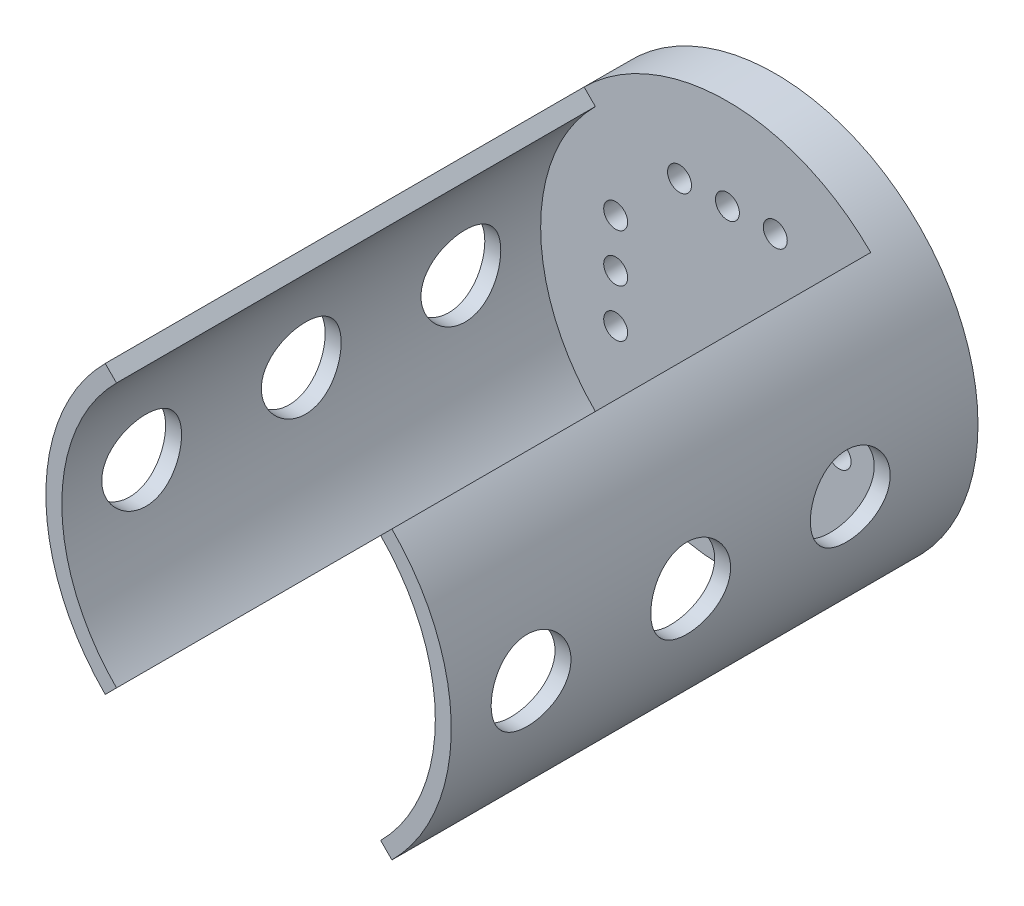
from build123d import *
from build123d.topology import SkipClean

# Parameters (mm, degrees)
SKETCH1_R                           = 12.7
BOSS_EXTRUDE1_DEPTH                 = 3
SKETCH2_R                           = 0.75
CUT_EXTRUDE1_DEPTH                  = 3
BOSS_EXTRUDE2_DEPTH                 = 30
CUT_EXTRUDE2_REACH                  = 39.571
CUT_EXTRUDE2_END_RADIUS             = 12.7
SKETCH4_R                           = 2.5
CUT_EXTRUDE2_DIRECTION_2_REACH      = 39.571
CUT_EXTRUDE2_DIRECTION_2_END_RADIUS = 12.7


with BuildPart() as part:
    # Sketch1 → Boss-Extrude1 (new body)
    with BuildSketch(Plane.XY):
        Circle(SKETCH1_R)
    extrude(amount=BOSS_EXTRUDE1_DEPTH)

    # Sketch2 → Cut-Extrude1 (cut)
    with BuildSketch(Plane.XY.offset(3)):
        with Locations((0, 7)):
            Circle(SKETCH2_R)
        with Locations((-3, 7)):
            Circle(SKETCH2_R)
        with Locations((3, 7)):
            Circle(SKETCH2_R)
        with Locations((7, -3)):
            Circle(SKETCH2_R)
        with Locations((7, 0)):
            Circle(SKETCH2_R)
        with Locations((7, 3)):
            Circle(SKETCH2_R)
        with Locations((-3, -7)):
            Circle(SKETCH2_R)
        with Locations((0, -7)):
            Circle(SKETCH2_R)
        with Locations((3, -7)):
            Circle(SKETCH2_R)
        with Locations((-7, 3)):
            Circle(SKETCH2_R)
        with Locations((-7, 0)):
            Circle(SKETCH2_R)
        with Locations((-7, -3)):
            Circle(SKETCH2_R)
    extrude(amount=-CUT_EXTRUDE1_DEPTH, mode=Mode.SUBTRACT)

    # Sketch3 → Boss-Extrude2 (add)
    with SkipClean():  # the faces are left unmerged after this step: merging them gives an invalid solid
        with BuildSketch(Plane.XY.offset(3)):
            with BuildLine():
                Line((-8.980256121, 8.980256121), (-8.273149436, 8.273149436))
                ThreePointArc((-8.273149436, 8.273149436), (-11.700000136, 0), (-8.27314937, -8.27314937))
                Line((-8.27314937, -8.27314937), (-8.980256121, -8.980256121))
                ThreePointArc((-8.980256121, -8.980256121), (-12.7, 0), (-8.980256121, 8.980256121))
            make_face()
            with BuildLine():
                Line((8.980256121, 8.980256121), (8.273149436, 8.273149436))
                ThreePointArc((8.273149436, 8.273149436), (11.700000136, 0), (8.27314937, -8.27314937))
                Line((8.27314937, -8.27314937), (8.980256121, -8.980256121))
                ThreePointArc((8.980256121, -8.980256121), (12.7, 0), (8.980256121, 8.980256121))
            make_face()
        extrude(amount=BOSS_EXTRUDE2_DEPTH)

    # Cut-Extrude2: up to this cylinder (the profile starts inside it)
    with SkipClean():  # the faces are left unmerged after this step: merging them gives an invalid solid
        cut_extrude2_end = Plane(origin=(0, 0, 18), z_dir=(0, 0, -1)) * Cylinder(CUT_EXTRUDE2_END_RADIUS, 125.542, mode=Mode.PRIVATE)
        # Sketch4 → Cut-Extrude2 (cut, up to the surface)
        with BuildSketch(Plane(origin=(0, 0, 0), x_dir=(0, 0, -1), z_dir=(1, 0, 0)), mode=Mode.PRIVATE) as cut_extrude2_sk1:
            with Locations((-8, 0)):
                Circle(SKETCH4_R)
        cut_extrude2_tool1 = extrude(cut_extrude2_sk1.sketch, amount=-CUT_EXTRUDE2_REACH, mode=Mode.PRIVATE) & cut_extrude2_end
        add(cut_extrude2_tool1.solids().sort_by_distance((0, 0, 8))[0], mode=Mode.SUBTRACT)
        # Sketch4 → Cut-Extrude2 (cut, up to the surface)
        with BuildSketch(Plane(origin=(0, 0, 0), x_dir=(0, 0, -1), z_dir=(1, 0, 0)), mode=Mode.PRIVATE) as cut_extrude2_sk2:
            with Locations((-18, 0)):
                Circle(SKETCH4_R)
        cut_extrude2_tool2 = extrude(cut_extrude2_sk2.sketch, amount=-CUT_EXTRUDE2_REACH, mode=Mode.PRIVATE) & cut_extrude2_end
        add(cut_extrude2_tool2.solids().sort_by_distance((0, 0, 18))[0], mode=Mode.SUBTRACT)
        # Sketch4 → Cut-Extrude2 (cut, up to the surface)
        with BuildSketch(Plane(origin=(0, 0, 0), x_dir=(0, 0, -1), z_dir=(1, 0, 0)), mode=Mode.PRIVATE) as cut_extrude2_sk3:
            with Locations((-28, 0)):
                Circle(SKETCH4_R)
        cut_extrude2_tool3 = extrude(cut_extrude2_sk3.sketch, amount=-CUT_EXTRUDE2_REACH, mode=Mode.PRIVATE) & cut_extrude2_end
        add(cut_extrude2_tool3.solids().sort_by_distance((0, 0, 28))[0], mode=Mode.SUBTRACT)

    # Cut-Extrude2 direction 2: up to this cylinder (the profile starts inside it)
    with SkipClean():  # the faces are left unmerged after this step: merging them gives an invalid solid
        cut_extrude2_direction_2_end = Plane(origin=(0, 0, 18), z_dir=(0, 0, -1)) * Cylinder(CUT_EXTRUDE2_DIRECTION_2_END_RADIUS, 125.542, mode=Mode.PRIVATE)
        # Sketch4 → Cut-Extrude2 direction 2 (cut, up to the surface)
        with BuildSketch(Plane(origin=(0, 0, 0), x_dir=(0, 0, -1), z_dir=(1, 0, 0)), mode=Mode.PRIVATE) as cut_extrude2_direction_2_sk1:
            with Locations((-8, 0)):
                Circle(SKETCH4_R)
        cut_extrude2_direction_2_tool1 = extrude(cut_extrude2_direction_2_sk1.sketch, amount=CUT_EXTRUDE2_DIRECTION_2_REACH, mode=Mode.PRIVATE) & cut_extrude2_direction_2_end
        add(cut_extrude2_direction_2_tool1.solids().sort_by_distance((0, 0, 8))[0], mode=Mode.SUBTRACT)
        # Sketch4 → Cut-Extrude2 direction 2 (cut, up to the surface)
        with BuildSketch(Plane(origin=(0, 0, 0), x_dir=(0, 0, -1), z_dir=(1, 0, 0)), mode=Mode.PRIVATE) as cut_extrude2_direction_2_sk2:
            with Locations((-18, 0)):
                Circle(SKETCH4_R)
        cut_extrude2_direction_2_tool2 = extrude(cut_extrude2_direction_2_sk2.sketch, amount=CUT_EXTRUDE2_DIRECTION_2_REACH, mode=Mode.PRIVATE) & cut_extrude2_direction_2_end
        add(cut_extrude2_direction_2_tool2.solids().sort_by_distance((0, 0, 18))[0], mode=Mode.SUBTRACT)
        # Sketch4 → Cut-Extrude2 direction 2 (cut, up to the surface)
        with BuildSketch(Plane(origin=(0, 0, 0), x_dir=(0, 0, -1), z_dir=(1, 0, 0)), mode=Mode.PRIVATE) as cut_extrude2_direction_2_sk3:
            with Locations((-28, 0)):
                Circle(SKETCH4_R)
        cut_extrude2_direction_2_tool3 = extrude(cut_extrude2_direction_2_sk3.sketch, amount=CUT_EXTRUDE2_DIRECTION_2_REACH, mode=Mode.PRIVATE) & cut_extrude2_direction_2_end
        add(cut_extrude2_direction_2_tool3.solids().sort_by_distance((0, 0, 28))[0], mode=Mode.SUBTRACT)


solid = part.part
